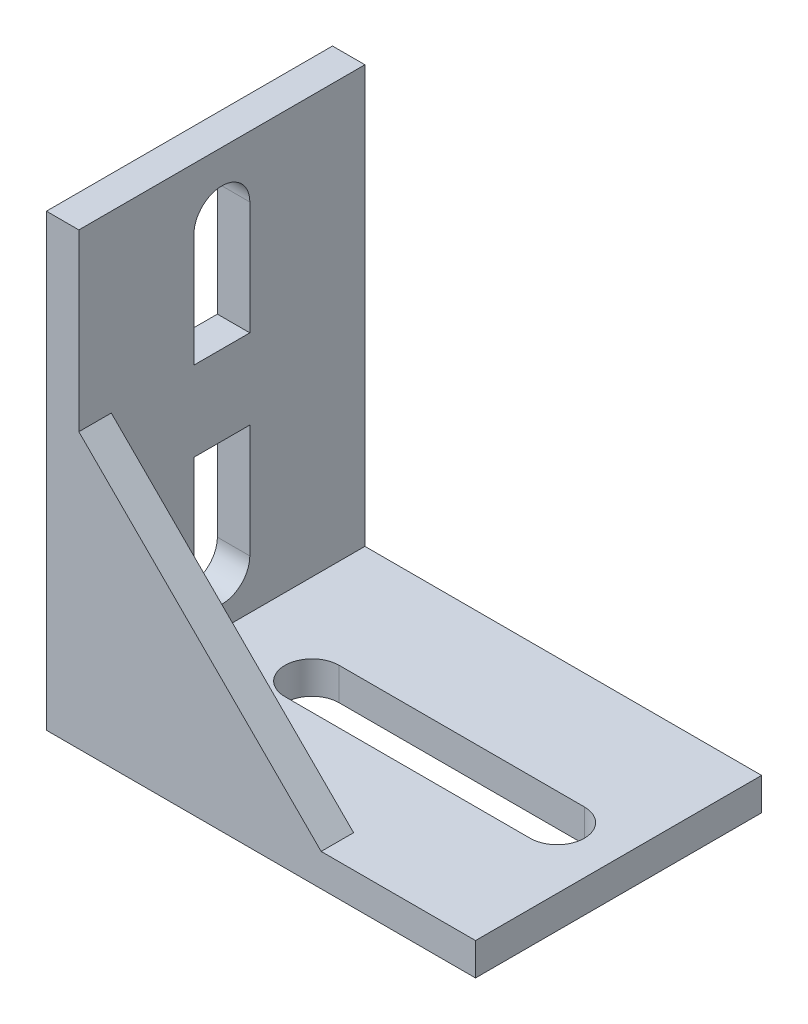
from build123d import *

# Parameters (mm, degrees)
CROQUIS1_W              = 70
CROQUIS1_H              = 110
CROQUIS1_W_2            = 13.66965824
CROQUIS1_H_2            = 19.532598364
SALIENTE_EXTRUIR1_DEPTH = 7.9375
CROQUIS2_W              = 97.0625
CROQUIS2_H              = 70
SALIENTE_EXTRUIR2_DEPTH = 7.9375
SALIENTE_EXTRUIR3_DEPTH = 7.9375


with BuildPart() as part:
    # Croquis1 → Saliente-Extruir1 (new body)
    # profile 1 of 2: a face of its own
    with BuildSketch(Plane(origin=(0, 0, 0), x_dir=(0, 0, -1), z_dir=(1, 0, 0))):
        with Locations((0, 25)):
            Rectangle(CROQUIS1_W, CROQUIS1_H)
        with BuildLine():
            Line((6.83482912, 65), (6.83482912, -10))
            ThreePointArc((6.83482912, -10), (0, -16.83482912), (-6.83482912, -10))
            Line((-6.83482912, -10), (-6.83482912, 65))
            ThreePointArc((-6.83482912, 65), (0, 71.83482912), (6.83482912, 65))
        make_face(mode=Mode.SUBTRACT)
    # profile 2 of 2: a face of its own
    with BuildSketch(Plane(origin=(0, 0, 0), x_dir=(0, 0, -1), z_dir=(1, 0, 0))):
        with Locations((0, 27.5)):
            Rectangle(CROQUIS1_W_2, CROQUIS1_H_2)
    extrude(amount=SALIENTE_EXTRUIR1_DEPTH)

    # Croquis2 → Saliente-Extruir2 (add)
    with BuildSketch(Plane.XZ.offset(30)):
        with Locations((56.46875, 0)):
            Rectangle(CROQUIS2_W, CROQUIS2_H)
        with BuildLine():
            ThreePointArc((30, -6.640349162), (23.359650838, 0), (30, 6.640349162))
            Line((30, 6.640349162), (90, 6.640349162))
            ThreePointArc((90, 6.640349162), (96.640349162, 0), (90, -6.640349162))
            Line((90, -6.640349162), (30, -6.640349162))
        make_face(mode=Mode.SUBTRACT)
    extrude(amount=-SALIENTE_EXTRUIR2_DEPTH)

    # Croquis3 → Saliente-Extruir3 (add)
    with BuildSketch(Plane(origin=(0, 0, 35), x_dir=(-1, 0, 0), z_dir=(0, 0, -1))):
        Polygon((0, 45.166428926), (-75.166428926, -30), (0, -30), align=None)
    extrude(amount=SALIENTE_EXTRUIR3_DEPTH)


solid = part.part
